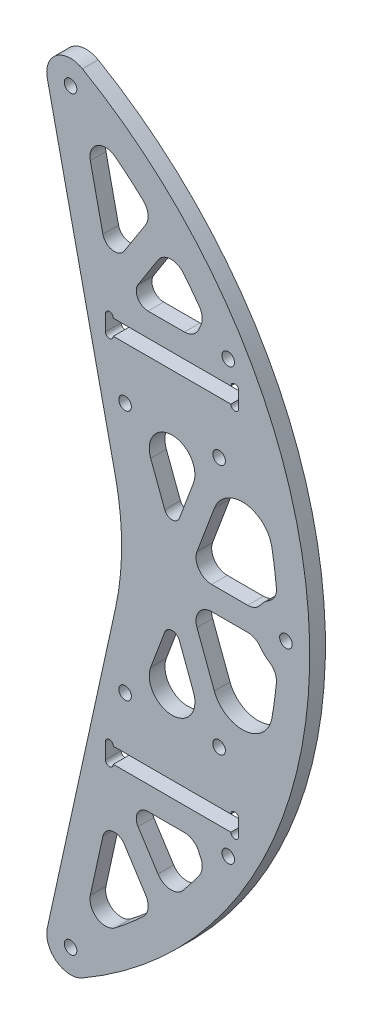
from build123d import *

# Parameters (mm, degrees)
BOSS_EXTRUDE1_DEPTH    = 6.35
F_10_CLEARANCE_HOLE1_D = 5.1054
CUT_EXTRUDE3_DEPTH     = 307.055384949
F_10_CLEARANCE_HOLE2_D = 5.1054
CUT_EXTRUDE4_DEPTH     = 307.055384949


with BuildPart() as part:
    # Sketch1 → Boss-Extrude1 (new body)
    with BuildSketch(Plane.XY):
        with BuildLine():
            Line((181.643586711, 23.126878769), (154.024056399, 149.054046391))
            ThreePointArc((154.024056399, 149.054046391), (157.752642202, 158.91005377), (168.275, 159.478578107))
            ThreePointArc((168.275, 159.478578107), (260.35, 0), (168.275, -159.478578107))
            ThreePointArc((168.275, -159.478578107), (157.752642202, -158.91005377), (154.024056399, -149.054046391))
            Line((154.024056399, -149.054046391), (181.643586711, -23.126878769))
            ThreePointArc((181.643586711, -23.126878769), (184.15, 0), (181.643586711, 23.126878769))
        make_face()
    extrude(amount=BOSS_EXTRUDE1_DEPTH)

    # #10 Clearance Hole1 (through all)
    with Locations(Plane(origin=(0, 0, 0), x_dir=(-1, 0, 0), z_dir=(0, 0, -1))):
        with Locations((-227.32143296, 87.25), (-250.7, 0), (-227.32143296, -87.25), (-163.45, 151.12143296), (-163.45, -151.12143296)):
            Hole(F_10_CLEARANCE_HOLE1_D / 2)

    # Sketch4 → Cut-Extrude3 (cut, through all)
    with BuildSketch(Plane(origin=(0, 0, 0), x_dir=(-1, 0, 0), z_dir=(0, 0, -1))):
        with BuildLine():
            Line((-228.389567551, -71.9105), (-180.764567551, -71.9105))
            ThreePointArc((-180.764567551, -71.9105), (-179.177067551, -70.323), (-177.589567551, -71.9105))
            Line((-177.589567551, -71.9105), (-177.589567551, -78.2605))
            ThreePointArc((-177.589567551, -78.2605), (-179.177067551, -79.848), (-180.764567551, -78.2605))
            Line((-180.764567551, -78.2605), (-228.389567551, -78.2605))
            ThreePointArc((-228.389567551, -78.2605), (-229.977067551, -79.848), (-231.564567551, -78.2605))
            Line((-231.564567551, -78.2605), (-231.564567551, -71.9105))
            ThreePointArc((-231.564567551, -71.9105), (-229.977067551, -70.323), (-228.389567551, -71.9105))
        make_face()
        with BuildLine():
            Line((-228.389567551, 78.2605), (-180.764567551, 78.2605))
            ThreePointArc((-180.764567551, 78.2605), (-179.177067551, 79.848), (-177.589567551, 78.2605))
            Line((-177.589567551, 78.2605), (-177.589567551, 71.9105))
            ThreePointArc((-177.589567551, 71.9105), (-179.177067551, 70.323), (-180.764567551, 71.9105))
            Line((-180.764567551, 71.9105), (-228.389567551, 71.9105))
            ThreePointArc((-228.389567551, 71.9105), (-229.977067551, 70.323), (-231.564567551, 71.9105))
            Line((-231.564567551, 71.9105), (-231.564567551, 78.2605))
            ThreePointArc((-231.564567551, 78.2605), (-229.977067551, 79.848), (-228.389567551, 78.2605))
        make_face()
    extrude(amount=-CUT_EXTRUDE3_DEPTH, mode=Mode.SUBTRACT)

    # #10 Clearance Hole2 (through all)
    with Locations(Plane(origin=(0, 0, 0), x_dir=(-1, 0, 0), z_dir=(0, 0, -1))):
        with Locations((-223.627067551, -50.8), (-185.527067551, 50.8), (-185.527067551, -50.8), (-223.627067551, 50.8)):
            Hole(F_10_CLEARANCE_HOLE2_D / 2)

    # Sketch7 → Cut-Extrude4 (cut, through all)
    with BuildSketch(Plane.XY.offset(6.35)):
        with BuildLine():
            Line((171.447975375, 128.892419043), (176.557773829, 105.595047978))
            ThreePointArc((176.557773829, 105.595047978), (180.372120431, 101.927081823), (185.220566537, 104.0474087))
            Line((185.220566537, 104.0474087), (193.878903814, 117.570865625))
            ThreePointArc((193.878903814, 117.570865625), (194.830328056, 121.796002086), (192.851503517, 125.648435037))
            ThreePointArc((192.851503517, 125.648435037), (187.306031839, 130.577762996), (181.552483119, 135.262547664))
            ThreePointArc((181.552483119, 135.262547664), (174.264118198, 135.62447632), (171.447975375, 128.892419043))
        make_face()
        with BuildLine():
            Line((194.823071175, 87.7855), (209.559327518, 87.7855))
            ThreePointArc((209.559327518, 87.7855), (213.147376547, 88.896377538), (215.480029332, 91.840333333))
            ThreePointArc((215.480029332, 91.840333333), (215.758641305, 92.502794413), (216.074279397, 93.148435108))
            ThreePointArc((216.074279397, 93.148435108), (216.785537654, 96.536247046), (215.614191178, 99.793716226))
            ThreePointArc((215.614191178, 99.793716226), (212.440037594, 104.085323924), (209.133824342, 108.276040036))
            ThreePointArc((209.133824342, 108.276040036), (203.848471686, 110.605496492), (198.862523013, 107.689740001))
            Line((198.862523013, 107.689740001), (190.81220141, 95.115942753))
            ThreePointArc((190.81220141, 95.115942753), (190.645079217, 90.262001434), (194.823071175, 87.7855))
        make_face()
        with BuildLine():
            Line((195.918284861, 36.653693121), (201.604222413, 21.491192982))
            ThreePointArc((201.604222413, 21.491192982), (204.577067551, 19.431009909), (207.54991269, 21.491192982))
            Line((207.54991269, 21.491192982), (213.235850242, 36.653693121))
            ThreePointArc((213.235850242, 36.653693121), (204.577067551, 49.148320597), (195.918284861, 36.653693121))
        make_face()
        with BuildLine():
            Line((221.69502961, 32.084292878), (214.666719976, 13.342133854))
            ThreePointArc((214.666719976, 13.342133854), (215.393182582, 7.49557278), (220.612410254, 4.7625))
            Line((220.612410254, 4.7625), (235.226963978, 4.7625))
            ThreePointArc((235.226963978, 4.7625), (238.125329178, 5.462546092), (240.384642652, 7.408333333))
            ThreePointArc((240.384642652, 7.408333333), (241.986845697, 9.239639717), (243.908896848, 10.731771428))
            ThreePointArc((243.908896848, 10.731771428), (246.218770536, 13.3100735), (246.833089321, 16.716797801))
            ThreePointArc((246.833089321, 16.716797801), (246.052937647, 23.346992794), (245.01525918, 29.941789658))
            ThreePointArc((245.01525918, 29.941789658), (234.172596645, 39.910658767), (221.69502961, 32.084292878))
        make_face()
        with BuildLine():
            Line((235.226963978, -4.7625), (220.612410254, -4.7625))
            ThreePointArc((220.612410254, -4.7625), (215.393182582, -7.49557278), (214.666719976, -13.342133854))
            Line((214.666719976, -13.342133854), (221.69502961, -32.084292878))
            ThreePointArc((221.69502961, -32.084292878), (234.172596645, -39.910658767), (245.01525918, -29.941789658))
            ThreePointArc((245.01525918, -29.941789658), (246.052937647, -23.346992794), (246.833089321, -16.716797801))
            ThreePointArc((246.833089321, -16.716797801), (246.218770536, -13.3100735), (243.908896848, -10.731771428))
            ThreePointArc((243.908896848, -10.731771428), (241.986845697, -9.239639717), (240.384642652, -7.408333333))
            ThreePointArc((240.384642652, -7.408333333), (238.125329178, -5.462546092), (235.226963978, -4.7625))
        make_face()
        with BuildLine():
            Line((213.235850242, -36.653693121), (207.54991269, -21.491192982))
            ThreePointArc((207.54991269, -21.491192982), (204.577067551, -19.431009909), (201.604222413, -21.491192982))
            Line((201.604222413, -21.491192982), (195.918284861, -36.653693121))
            ThreePointArc((195.918284861, -36.653693121), (204.577067551, -49.148320597), (213.235850242, -36.653693121))
        make_face()
        with BuildLine():
            Line((194.823071175, -87.7855), (209.559327518, -87.7855))
            ThreePointArc((209.559327518, -87.7855), (213.147376547, -88.896377538), (215.480029332, -91.840333333))
            ThreePointArc((215.480029332, -91.840333333), (215.758641305, -92.502794413), (216.074279397, -93.148435108))
            ThreePointArc((216.074279397, -93.148435108), (216.785537654, -96.536247046), (215.614191178, -99.793716226))
            ThreePointArc((215.614191178, -99.793716226), (212.440037594, -104.085323924), (209.133824342, -108.276040036))
            ThreePointArc((209.133824342, -108.276040036), (203.848471686, -110.605496492), (198.862523013, -107.689740001))
            Line((198.862523013, -107.689740001), (190.81220141, -95.115942753))
            ThreePointArc((190.81220141, -95.115942753), (190.645079217, -90.262001434), (194.823071175, -87.7855))
        make_face()
        with BuildLine():
            Line((185.220566537, -104.0474087), (193.878903814, -117.570865625))
            ThreePointArc((193.878903814, -117.570865625), (194.830328056, -121.796002086), (192.851503517, -125.648435037))
            ThreePointArc((192.851503517, -125.648435037), (187.306031839, -130.577762996), (181.552483119, -135.262547664))
            ThreePointArc((181.552483119, -135.262547664), (174.264118198, -135.62447632), (171.447975375, -128.892419043))
            Line((171.447975375, -128.892419043), (176.557773829, -105.595047978))
            ThreePointArc((176.557773829, -105.595047978), (180.372120431, -101.927081823), (185.220566537, -104.0474087))
        make_face()
    extrude(amount=-CUT_EXTRUDE4_DEPTH, mode=Mode.SUBTRACT)


solid = part.part
